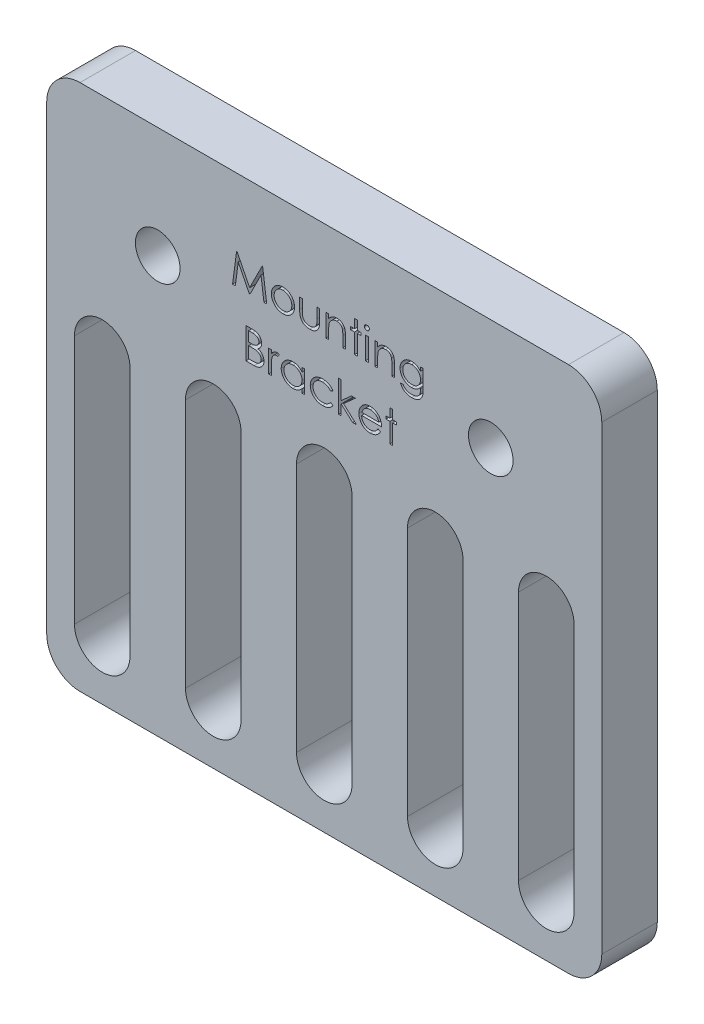
from build123d import *

# Parameters (mm, degrees)
SKETCH1_W           = 63.5
SKETCH1_H           = 60.325
BOSS_EXTRUDE1_DEPTH = 6.35
SKETCH2_R           = 2.5527
CUT_EXTRUDE1_DEPTH  = 113.534652957
FILLET2_R           = 3.81
FILLET3_R           = 3.81
SKETCH3_W           = 0.314102564
SKETCH3_H           = 2.557692308
CUT_EXTRUDE5_DEPTH  = 6.35
SKETCH4_R           = 1.7272
CUT_EXTRUDE6_DEPTH  = 6.35


with BuildPart() as part:
    # Sketch1 → Boss-Extrude1 (new body)
    with BuildSketch(Plane.XY):
        with Locations((-67.970991068, 21.600899779)):
            Rectangle(SKETCH1_W, SKETCH1_H)
    extrude(amount=BOSS_EXTRUDE1_DEPTH)

    # Sketch2 → Cut-Extrude1 (cut, through all)
    with BuildSketch(Plane.XY.offset(6.35)):
        with Locations((-87.020991068, 39.063399779)):
            Circle(SKETCH2_R)
        with Locations((-48.920991068, 39.063399779)):
            Circle(SKETCH2_R)
        with BuildLine():
            Line((-90.195991068, 26.363399779), (-90.195991068, -2.211600221))
            ThreePointArc((-90.195991068, -2.211600221), (-93.370991068, -5.386600221), (-96.545991068, -2.211600221))
            Line((-96.545991068, -2.211600221), (-96.545991068, 26.363399779))
            ThreePointArc((-96.545991068, 26.363399779), (-93.370991068, 29.538399779), (-90.195991068, 26.363399779))
        make_face()
        with BuildLine():
            Line((-77.495991068, 26.363399779), (-77.495991068, -2.211600221))
            ThreePointArc((-77.495991068, -2.211600221), (-80.670991068, -5.386600221), (-83.845991068, -2.211600221))
            Line((-83.845991068, -2.211600221), (-83.845991068, 26.363399779))
            ThreePointArc((-83.845991068, 26.363399779), (-80.670991068, 29.538399779), (-77.495991068, 26.363399779))
        make_face()
        with BuildLine():
            Line((-64.795991068, 26.363399779), (-64.795991068, -2.211600221))
            ThreePointArc((-64.795991068, -2.211600221), (-67.970991068, -5.386600221), (-71.145991068, -2.211600221))
            Line((-71.145991068, -2.211600221), (-71.145991068, 26.363399779))
            ThreePointArc((-71.145991068, 26.363399779), (-67.970991068, 29.538399779), (-64.795991068, 26.363399779))
        make_face()
        with BuildLine():
            Line((-52.095991068, 26.363399779), (-52.095991068, -2.211600221))
            ThreePointArc((-52.095991068, -2.211600221), (-55.270991068, -5.386600221), (-58.445991068, -2.211600221))
            Line((-58.445991068, -2.211600221), (-58.445991068, 26.363399779))
            ThreePointArc((-58.445991068, 26.363399779), (-55.270991068, 29.538399779), (-52.095991068, 26.363399779))
        make_face()
        with BuildLine():
            Line((-39.395991068, 26.363399779), (-39.395991068, -2.211600221))
            ThreePointArc((-39.395991068, -2.211600221), (-42.570991068, -5.386600221), (-45.745991068, -2.211600221))
            Line((-45.745991068, -2.211600221), (-45.745991068, 26.363399779))
            ThreePointArc((-45.745991068, 26.363399779), (-42.570991068, 29.538399779), (-39.395991068, 26.363399779))
        make_face()
    extrude(amount=-CUT_EXTRUDE1_DEPTH, mode=Mode.SUBTRACT)

    # Fillet2
    fillet2_edges = [part.edges().sort_by_distance(p)[0] for p in [
        (-36.220991068, 51.763399779, 3.175),
    ]]
    fillet(fillet2_edges, radius=FILLET2_R)

    # Fillet3
    fillet3_edges = [part.edges().sort_by_distance(p)[0] for p in [
        (-99.720991068, 51.763399779, 3.175),
        (-36.220991068, -8.561600221, 3.175),
        (-99.720991068, -8.561600221, 3.175),
    ]]
    fillet(fillet3_edges, radius=FILLET3_R)

    # Sketch3 → Cut-Extrude5 (cut)
    # profile 1 of 16: a face of its own
    with BuildSketch(Plane.XY.offset(6.35)):
        Polygon((-78.458521086, 40.516400784), (-77.996481824, 44.016400784), (-77.951610029, 44.016400784), (-76.506598009, 41.144605912), (-75.065091599, 44.016400784), (-75.019518683, 44.016400784), (-74.554674933, 40.516400784), (-74.87017974, 40.516400784), (-75.205315958, 43.034830271), (-76.468737433, 40.516400784), (-76.539550734, 40.516400784), (-77.807880061, 43.040439246), (-78.142315157, 40.516400784), align=None)
    # profile 2 of 16: a face of its own
    with BuildSketch(Plane.XY.offset(6.35)):
        with BuildLine():
            add(Edge.make_bspline(
                [(-72.691093202, 43.118964887), (-72.643101929, 43.117942996), (-72.549002771, 43.115939317), (-72.411194885, 43.094524351), (-72.27964975, 43.061776987), (-72.153863557, 43.016505425), (-72.035447262, 42.955823474), (-71.922676018, 42.883414183), (-71.815859009, 42.797631589), (-71.75183598, 42.731273521), (-71.719338394, 42.697590688)],
                knots=[0, 0, 0, 0, 1.054011418, 2.066658804, 3.057071809, 4.030435133, 4.997543892, 5.974964718, 6.972108034, 8, 8, 8, 8], degree=3))
            add(Edge.make_bspline(
                [(-71.719338394, 42.697590688), (-71.69135644, 42.665376702), (-71.63593406, 42.60157216), (-71.564868341, 42.498116547), (-71.503646781, 42.390976446), (-71.45458382, 42.27872912), (-71.415898796, 42.162354449), (-71.3884331, 42.041452437), (-71.372096165, 41.91629009), (-71.369893198, 41.831286252), (-71.368777497, 41.78823572)],
                knots=[0, 0, 0, 0, 1.025258237, 2.030674902, 3.01204498, 3.988269485, 4.97094183, 5.956517959, 6.965070386, 8, 8, 8, 8], degree=3))
            add(Edge.make_bspline(
                [(-71.368777497, 41.78823572), (-71.369758834, 41.744935662), (-71.371698002, 41.659372729), (-71.390041619, 41.533353363), (-71.418572705, 41.411158541), (-71.459404543, 41.293299847), (-71.511762652, 41.179417019), (-71.575653339, 41.07000747), (-71.651524957, 40.964855337), (-71.737528953, 40.864853499), (-71.83258083, 40.772687284), (-71.935696978, 40.692359014), (-72.044851012, 40.62353749), (-72.161494365, 40.568101074), (-72.284561852, 40.524391374), (-72.41431892, 40.493691358), (-72.55056399, 40.475129674), (-72.643591212, 40.4727461), (-72.691093202, 40.471528989)],
                knots=[0, 0, 0, 0, 0.998656419, 1.973391657, 2.932242238, 3.890759089, 4.846373663, 5.82037756, 6.809684879, 7.83454468, 8.860553229, 9.859544525, 10.845671541, 11.83227036, 12.833544569, 13.85385346, 14.904124723, 16, 16, 16, 16], degree=3))
            add(Edge.make_bspline(
                [(-72.691093202, 40.471528989), (-72.738827921, 40.472750185), (-72.832318781, 40.47514196), (-72.969044763, 40.493619243), (-73.099034382, 40.524377225), (-73.22226298, 40.568244718), (-73.339407827, 40.623539262), (-73.449194324, 40.692150951), (-73.55239424, 40.772711107), (-73.647466224, 40.864847044), (-73.73346483, 40.964857), (-73.809337838, 41.070007038), (-73.873228164, 41.179417132), (-73.925586368, 41.293299817), (-73.966418181, 41.411158549), (-73.994949273, 41.533353361), (-74.013292888, 41.65937273), (-74.015232057, 41.744935663), (-74.016213394, 41.78823572)],
                knots=[0, 0, 0, 0, 1.099876186, 2.154163076, 3.173186993, 4.173200201, 5.163417411, 6.152872554, 7.150605724, 8.17532212, 9.198891216, 10.186952605, 11.159729845, 12.11414092, 13.071450619, 14.029093627, 15.002601286, 16, 16, 16, 16], degree=3))
            add(Edge.make_bspline(
                [(-74.016213394, 41.78823572), (-74.015090084, 41.831052266), (-74.012866122, 41.915821668), (-73.996545613, 42.040748729), (-73.969187057, 42.161446118), (-73.93045566, 42.277371594), (-73.880940469, 42.38912703), (-73.820579181, 42.496531861), (-73.748788549, 42.599519662), (-73.693586597, 42.663241742), (-73.665652497, 42.695487323)],
                knots=[0, 0, 0, 0, 1.031353054, 2.041901799, 3.029428768, 4.008703097, 4.981709435, 5.96992636, 6.972712378, 8, 8, 8, 8], degree=3))
            add(Edge.make_bspline(
                [(-73.665652497, 42.695487323), (-73.633203906, 42.729462262), (-73.569388042, 42.796279958), (-73.462039314, 42.881812482), (-73.349545493, 42.955728556), (-73.229820567, 43.015204771), (-73.104137709, 43.062043289), (-72.971918466, 43.094608804), (-72.833642951, 43.115862159), (-72.73908333, 43.117920337), (-72.691093202, 43.118964887)],
                knots=[0, 0, 0, 0, 1.027980169, 2.021703884, 2.998553061, 3.971491411, 4.943284454, 5.930300938, 6.949603206, 8, 8, 8, 8], degree=3))
        make_face()
        with BuildLine():
            add(Edge.make_bspline(
                [(-72.692495445, 42.804862323), (-72.726433057, 42.803897731), (-72.793432185, 42.801993448), (-72.89205177, 42.787509544), (-72.986991924, 42.76456204), (-73.078432768, 42.731957983), (-73.166065941, 42.689859084), (-73.249975343, 42.638150724), (-73.330407783, 42.577517768), (-73.405789846, 42.508055096), (-73.474972158, 42.432176102), (-73.535450135, 42.351327743), (-73.586875241, 42.266821396), (-73.6297154, 42.178569185), (-73.661622588, 42.085676771), (-73.684795611, 41.98919614), (-73.699265851, 41.888930724), (-73.70115223, 41.820769705), (-73.70211083, 41.786132355)],
                knots=[0, 0, 0, 0, 1.021534396, 2.016698045, 2.994645724, 3.958388632, 4.93408049, 5.916473867, 6.921342795, 7.962252576, 8.998418191, 10.008913653, 10.997312074, 11.973003931, 12.956656626, 13.948281152, 14.957379055, 16, 16, 16, 16], degree=3))
            add(Edge.make_bspline(
                [(-73.70211083, 41.786132355), (-73.700504006, 41.741380327), (-73.697314762, 41.652555922), (-73.671379525, 41.521744799), (-73.627993246, 41.396162947), (-73.569405966, 41.276546561), (-73.495999747, 41.165874283), (-73.40951268, 41.067202799), (-73.31087298, 40.982016987), (-73.20125648, 40.911336142), (-73.082902162, 40.855176386), (-72.957645841, 40.81537741), (-72.827005147, 40.789505718), (-72.737724416, 40.786934244), (-72.692495445, 40.785631553)],
                knots=[0, 0, 0, 0, 1.016792936, 2.018143844, 3.017858371, 4.030088057, 5.03801393, 6.028138512, 7.003788237, 7.991172063, 8.984598303, 9.972568034, 10.972917682, 12, 12, 12, 12], degree=3))
            add(Edge.make_bspline(
                [(-72.692495445, 40.785631553), (-72.647269076, 40.786941834), (-72.55799348, 40.78952829), (-72.427534304, 40.81524711), (-72.302620332, 40.855350771), (-72.184388944, 40.911272981), (-72.074822341, 40.982285396), (-71.975473219, 41.066721773), (-71.889724608, 41.166135624), (-71.816391003, 41.276693153), (-71.756844261, 41.395977505), (-71.713661059, 41.521767977), (-71.687663473, 41.652550019), (-71.684482644, 41.74137835), (-71.682880061, 41.786132355)],
                knots=[0, 0, 0, 0, 1.02726834, 2.027799167, 3.010890988, 4.004497153, 4.992059811, 5.971914811, 6.958719428, 7.966827853, 8.981595046, 9.981490638, 10.983022906, 12, 12, 12, 12], degree=3))
            add(Edge.make_bspline(
                [(-71.682880061, 41.786132355), (-71.683838331, 41.820769912), (-71.68572406, 41.888931338), (-71.700199024, 41.989193792), (-71.723354564, 42.085685388), (-71.755326181, 42.178537392), (-71.797980195, 42.267049896), (-71.850396988, 42.351079623), (-71.910628014, 42.432456169), (-71.980645134, 42.50780981), (-72.055948512, 42.577544846), (-72.13641355, 42.638174236), (-72.220198529, 42.689631831), (-72.307577112, 42.732318072), (-72.399029679, 42.764265412), (-72.493836809, 42.787642044), (-72.592035618, 42.80193224), (-72.658794662, 42.803879382), (-72.692495445, 42.804862323)],
                knots=[0, 0, 0, 0, 1.042956736, 2.052379634, 3.044323526, 4.02829302, 5.004299113, 5.996692471, 7.007513377, 8.048758398, 9.090003419, 10.095195979, 11.07790575, 12.047570684, 13.018257071, 13.989683339, 14.985167495, 16, 16, 16, 16], degree=3))
        make_face(mode=Mode.SUBTRACT)
    # profile 3 of 16: a face of its own
    with BuildSketch(Plane.XY.offset(6.35)):
        with BuildLine():
            Line((-70.785444163, 43.074093092), (-70.471341599, 43.074093092))
            Line((-70.471341599, 43.074093092), (-70.471341599, 41.887795015))
            add(Edge.make_bspline(
                [(-70.471341599, 41.887795015), (-70.471199694, 41.852972266), (-70.470928237, 41.786357978), (-70.469087296, 41.690502791), (-70.464757202, 41.603086078), (-70.459343378, 41.524057342), (-70.452381242, 41.45342995), (-70.444097881, 41.391450593), (-70.43483946, 41.337416409), (-70.425776746, 41.304873053), (-70.421561952, 41.289738124)],
                knots=[0, 0, 0, 0, 1.388932606, 2.656963016, 3.823490214, 4.879454478, 5.816252168, 6.653371382, 7.373723809, 8, 8, 8, 8], degree=3))
            add(Edge.make_bspline(
                [(-70.421561952, 41.289738124), (-70.414800497, 41.270715253), (-70.401418156, 41.233064992), (-70.377144672, 41.178675987), (-70.347116335, 41.128300704), (-70.314256508, 41.079996631), (-70.2763571, 41.035194645), (-70.233897629, 40.993970401), (-70.188299392, 40.95476631), (-70.120544368, 40.908381518), (-70.027885102, 40.858666188), (-69.906232347, 40.815770369), (-69.774328121, 40.790134549), (-69.683163402, 40.787160294), (-69.636305542, 40.785631553)],
                knots=[0, 0, 0, 0, 0.725840625, 1.436591201, 2.137033971, 2.831655856, 3.53531722, 4.242432219, 4.957935707, 5.694543706, 7.190802206, 8.724350549, 10.316345118, 12, 12, 12, 12], degree=3))
            add(Edge.make_bspline(
                [(-69.636305542, 40.785631553), (-69.589452034, 40.787192802), (-69.498799165, 40.790213529), (-69.368344196, 40.814997068), (-69.249092782, 40.856402757), (-69.14224183, 40.914210169), (-69.04827599, 40.984952231), (-68.969971572, 41.06796104), (-68.905364317, 41.160610427), (-68.877154896, 41.229734706), (-68.862968202, 41.264497739)],
                knots=[0, 0, 0, 0, 1.157059328, 2.238695713, 3.266970494, 4.264342957, 5.228770407, 6.160125903, 7.074715775, 8, 8, 8, 8], degree=3))
            add(Edge.make_bspline(
                [(-68.862968202, 41.264497739), (-68.858773972, 41.278464038), (-68.849501553, 41.309340113), (-68.839539202, 41.361719862), (-68.83056474, 41.424184466), (-68.822901564, 41.497142675), (-68.817436401, 41.580403827), (-68.814490375, 41.673941904), (-68.8111621, 41.777463264), (-68.811111583, 41.849931023), (-68.811085189, 41.887795015)],
                knots=[0, 0, 0, 0, 0.557542046, 1.232589297, 2.036731608, 2.971723315, 4.038036528, 5.22795436, 6.551621927, 8, 8, 8, 8], degree=3))
            Line((-68.811085189, 41.887795015), (-68.811085189, 43.074093092))
            Line((-68.811085189, 43.074093092), (-68.496982625, 43.074093092))
            Line((-68.496982625, 43.074093092), (-68.496982625, 41.828900784))
            add(Edge.make_bspline(
                [(-68.496982625, 41.828900784), (-68.49742432, 41.786593613), (-68.498281268, 41.704511913), (-68.503788612, 41.585227801), (-68.513238224, 41.474065556), (-68.527580909, 41.370966337), (-68.544446584, 41.276008855), (-68.566202857, 41.189071409), (-68.592181094, 41.110421855), (-68.621486609, 41.038680078), (-68.656108477, 40.973633184), (-68.692935497, 40.911897367), (-68.735460269, 40.855004432), (-68.780230504, 40.800122295), (-68.830032159, 40.749980767), (-68.883932018, 40.703429292), (-68.941171438, 40.65975626), (-69.003020636, 40.62066498), (-69.068576699, 40.585448335), (-69.137920556, 40.554232257), (-69.211901554, 40.52952968), (-69.289565191, 40.508219014), (-69.371291971, 40.491504545), (-69.457003104, 40.479717978), (-69.54666972, 40.472492647), (-69.60777918, 40.471855602), (-69.639110029, 40.471528989)],
                knots=[0, 0, 0, 0, 1.493040784, 2.896703357, 4.213163133, 5.428574705, 6.569057535, 7.615249723, 8.588095153, 9.490268104, 10.346124644, 11.18633936, 12.024365274, 12.850166724, 13.684164916, 14.514361689, 15.362232829, 16.222528818, 17.093394965, 17.986930858, 18.902426812, 19.842810585, 20.827885679, 21.843828298, 22.894529745, 24, 24, 24, 24], degree=3))
            add(Edge.make_bspline(
                [(-69.639110029, 40.471528989), (-69.670206543, 40.471868696), (-69.731314088, 40.472536253), (-69.820985332, 40.47967806), (-69.906933938, 40.491486231), (-69.988854337, 40.508341448), (-70.066828734, 40.529380518), (-70.141172974, 40.554384054), (-70.211016537, 40.585464535), (-70.277198541, 40.620442093), (-70.339200929, 40.660007368), (-70.397309507, 40.703375408), (-70.45144636, 40.750481471), (-70.501623428, 40.801128828), (-70.547136405, 40.855945765), (-70.588552446, 40.914491325), (-70.626509151, 40.976185413), (-70.660861942, 41.042248576), (-70.690373697, 41.114820586), (-70.716428943, 41.195117683), (-70.737739582, 41.2840202), (-70.75508205, 41.381452128), (-70.769033491, 41.48694717), (-70.778719633, 41.601115585), (-70.784135464, 41.723679277), (-70.784998525, 41.808329167), (-70.785444163, 41.852037803)],
                knots=[0, 0, 0, 0, 1.083640291, 2.129454052, 3.13281866, 4.105697902, 5.042300162, 5.946461698, 6.836384745, 7.703652036, 8.553297018, 9.397182691, 10.228592656, 11.052265423, 11.879314572, 12.708807002, 13.549817954, 14.402308542, 15.300838682, 16.27712199, 17.341985831, 18.484375296, 19.725102775, 21.0496083, 22.476576903, 24, 24, 24, 24], degree=3))
            Line((-70.785444163, 41.852037803), (-70.785444163, 43.074093092))
        make_face()
    # profile 4 of 16: a face of its own
    with BuildSketch(Plane.XY.offset(6.35)):
        with BuildLine():
            Line((-67.779033907, 43.074093092), (-67.464931343, 43.074093092))
            Line((-67.464931343, 43.074093092), (-67.464931343, 42.612754951))
            add(Edge.make_bspline(
                [(-67.464931343, 42.612754951), (-67.431393708, 42.654597674), (-67.366312757, 42.735794937), (-67.257928423, 42.842515512), (-67.143384523, 42.930460737), (-67.02338252, 43.000564531), (-66.897759509, 43.053411157), (-66.767281239, 43.091577088), (-66.631166533, 43.114461916), (-66.538602096, 43.117452147), (-66.491774292, 43.118964887)],
                knots=[0, 0, 0, 0, 1.12780773, 2.188550248, 3.19190651, 4.159438251, 5.104880172, 6.052711206, 7.014878035, 8, 8, 8, 8], degree=3))
            add(Edge.make_bspline(
                [(-66.491774292, 43.118964887), (-66.444443657, 43.117219691), (-66.35180619, 43.113803923), (-66.216928128, 43.086787232), (-66.090954735, 43.040641977), (-65.974335179, 42.977429906), (-65.869207965, 42.898823433), (-65.776883114, 42.807245651), (-65.700519867, 42.701909568), (-65.649322504, 42.604186412), (-65.615596856, 42.517497617), (-65.594364518, 42.443250867), (-65.576333537, 42.360532716), (-65.560701789, 42.269593127), (-65.550124677, 42.169794937), (-65.541782385, 42.061547245), (-65.535803691, 41.944885114), (-65.535566484, 41.864198487), (-65.535444163, 41.822590688)],
                knots=[0, 0, 0, 0, 1.235846778, 2.418850247, 3.575807741, 4.728682307, 5.871620074, 6.994088408, 8.11269785, 9.256955736, 9.865816715, 10.540099792, 11.271859618, 12.076849838, 12.949306005, 13.892391288, 14.913166135, 16, 16, 16, 16], degree=3))
            Line((-65.535444163, 41.822590688), (-65.535444163, 40.516400784))
            Line((-65.535444163, 40.516400784), (-65.849546727, 40.516400784))
            Line((-65.849546727, 40.516400784), (-65.849546727, 41.719525784))
            add(Edge.make_bspline(
                [(-65.849546727, 41.719525784), (-65.849739935, 41.754348229), (-65.850109509, 41.82095764), (-65.851275156, 41.916326663), (-65.854084963, 42.002813241), (-65.858033276, 42.080210609), (-65.863812306, 42.148444445), (-65.869834938, 42.207653722), (-65.877199914, 42.257763265), (-65.883762827, 42.287928347), (-65.886706183, 42.301456874)],
                knots=[0, 0, 0, 0, 1.430800155, 2.736877192, 3.918605307, 4.986035426, 5.920637409, 6.731861385, 7.431261377, 8, 8, 8, 8], degree=3))
            add(Edge.make_bspline(
                [(-65.886706183, 42.301456874), (-65.897331714, 42.341168059), (-65.917782575, 42.417599803), (-65.968316558, 42.521274156), (-66.032130739, 42.609472344), (-66.110028588, 42.681649066), (-66.201257664, 42.737819902), (-66.305564806, 42.776793857), (-66.421943447, 42.801170126), (-66.50379783, 42.803597258), (-66.546461792, 42.804862323)],
                knots=[0, 0, 0, 0, 1.084156227, 2.086665306, 3.027808233, 3.945421172, 4.874247719, 5.839848303, 6.874090471, 8, 8, 8, 8], degree=3))
            add(Edge.make_bspline(
                [(-66.546461792, 42.804862323), (-66.571729475, 42.804386318), (-66.621733568, 42.803444317), (-66.69588354, 42.793993019), (-66.767807713, 42.778534563), (-66.838227922, 42.757665926), (-66.905735716, 42.729003657), (-66.972500007, 42.696474286), (-67.036006771, 42.655926074), (-67.097610168, 42.610735453), (-67.154922976, 42.560656246), (-67.208251314, 42.507811736), (-67.255789335, 42.451536132), (-67.29885801, 42.392736184), (-67.336036273, 42.330604346), (-67.368489361, 42.26574004), (-67.396025056, 42.198057891), (-67.409707749, 42.15108283), (-67.416553939, 42.127578669)],
                knots=[0, 0, 0, 0, 1.023777757, 2.026029729, 3.023749952, 4.003683103, 4.997618607, 5.993177895, 7.010360494, 8.046726602, 9.087585522, 10.09234134, 11.086953743, 12.070360549, 13.043493632, 14.017870808, 15.008233677, 16, 16, 16, 16], degree=3))
            add(Edge.make_bspline(
                [(-67.416553939, 42.127578669), (-67.420493588, 42.110323466), (-67.429069996, 42.072759791), (-67.438333176, 42.011115372), (-67.446740752, 41.939805397), (-67.45377771, 41.85891308), (-67.458083127, 41.768155205), (-67.462777523, 41.667919367), (-67.464486585, 41.557805879), (-67.464778939, 41.481144186), (-67.464931343, 41.441180432)],
                knots=[0, 0, 0, 0, 0.615963638, 1.340920617, 2.168419149, 3.115676021, 4.16674242, 5.331190069, 6.6087489, 8, 8, 8, 8], degree=3))
            Line((-67.464931343, 41.441180432), (-67.464931343, 40.516400784))
            Line((-67.464931343, 40.516400784), (-67.779033907, 40.516400784))
            Line((-67.779033907, 40.516400784), (-67.779033907, 43.074093092))
        make_face()
    # profile 5 of 16: a face of its own
    with BuildSketch(Plane.XY.offset(6.35)):
        Polygon((-64.503392881, 44.106144374), (-64.189290317, 44.106144374), (-64.189290317, 43.074093092), (-63.740572368, 43.074093092), (-63.740572368, 42.759990528), (-64.189290317, 42.759990528), (-64.189290317, 40.516400784), (-64.503392881, 40.516400784), (-64.503392881, 42.759990528), (-64.95211083, 42.759990528), (-64.95211083, 43.074093092), (-64.503392881, 43.074093092), align=None)
    # profile 6 of 16: a face of its own
    with BuildSketch(Plane.XY.offset(6.35)):
        with BuildLine():
            add(Edge.make_bspline(
                [(-63.091333586, 44.151016169), (-63.071842271, 44.150112016), (-63.033674531, 44.148341512), (-62.978481263, 44.133180035), (-62.928224251, 44.10748035), (-62.883646518, 44.073000669), (-62.845394631, 44.032451225), (-62.818613921, 43.985190257), (-62.801401525, 43.934131618), (-62.79932297, 43.898516529), (-62.798264676, 43.880383156)],
                knots=[0, 0, 0, 0, 1.055194115, 2.066272739, 3.074728998, 4.095836921, 5.109056067, 6.073838105, 7.019297344, 8, 8, 8, 8], degree=3))
            add(Edge.make_bspline(
                [(-62.798264676, 43.880383156), (-62.799346836, 43.862720503), (-62.801486138, 43.827803528), (-62.818600626, 43.777630056), (-62.845622864, 43.731025772), (-62.88362199, 43.690555062), (-62.928230751, 43.656094442), (-62.978479536, 43.630389703), (-63.033674985, 43.615229566), (-63.071842424, 43.613458877), (-63.091333586, 43.61255463)],
                knots=[0, 0, 0, 0, 0.96129708, 1.900370562, 2.859976407, 3.87933698, 4.906634145, 5.921202961, 6.938410037, 8, 8, 8, 8], degree=3))
            add(Edge.make_bspline(
                [(-63.091333586, 43.61255463), (-63.110601862, 43.613424351), (-63.148105042, 43.615117147), (-63.202471884, 43.630687165), (-63.252300373, 43.656103238), (-63.296965046, 43.690329423), (-63.334195239, 43.73127432), (-63.361293565, 43.777601614), (-63.378368527, 43.827810769), (-63.380513155, 43.862722935), (-63.381598009, 43.880383156)],
                knots=[0, 0, 0, 0, 1.054934014, 2.053291228, 3.073705704, 4.106921865, 5.123545215, 6.088680038, 7.033164197, 8, 8, 8, 8], degree=3))
            add(Edge.make_bspline(
                [(-63.381598009, 43.880383156), (-63.380536923, 43.898514006), (-63.378452882, 43.934124138), (-63.361280766, 43.985219171), (-63.334420958, 44.032200673), (-63.296940394, 44.073226172), (-63.252306934, 44.107471607), (-63.202470189, 44.132882589), (-63.14810549, 44.148453928), (-63.110602014, 44.150146542), (-63.091333586, 44.151016169)],
                knots=[0, 0, 0, 0, 0.98631895, 1.937192651, 2.907499808, 3.917963147, 4.944918757, 5.95915025, 6.951458133, 8, 8, 8, 8], degree=3))
        make_face()
    # profile 7 of 16: a face of its own
    with BuildSketch(Plane.XY.offset(6.35)):
        with Locations((-63.089931343, 41.795246938)):
            Rectangle(SKETCH3_W, SKETCH3_H)
    # profile 8 of 16: a face of its own
    with BuildSketch(Plane.XY.offset(6.35)):
        with BuildLine():
            Line((-62.170059548, 43.074093092), (-61.855956984, 43.074093092))
            Line((-61.855956984, 43.074093092), (-61.855956984, 42.612754951))
            add(Edge.make_bspline(
                [(-61.855956984, 42.612754951), (-61.822419349, 42.654597674), (-61.757338398, 42.735794937), (-61.648954064, 42.842515512), (-61.534410164, 42.930460737), (-61.414408161, 43.000564531), (-61.28878515, 43.053411157), (-61.15830688, 43.091577088), (-61.022192174, 43.114461916), (-60.929627738, 43.117452147), (-60.882799933, 43.118964887)],
                knots=[0, 0, 0, 0, 1.12780773, 2.188550248, 3.19190651, 4.159438251, 5.104880172, 6.052711206, 7.014878035, 8, 8, 8, 8], degree=3))
            add(Edge.make_bspline(
                [(-60.882799933, 43.118964887), (-60.835469298, 43.117219691), (-60.742831831, 43.113803923), (-60.607953769, 43.086787232), (-60.481980376, 43.040641977), (-60.36536082, 42.977429906), (-60.260233606, 42.898823433), (-60.167908755, 42.807245651), (-60.091545508, 42.701909568), (-60.040348145, 42.604186412), (-60.006622497, 42.517497617), (-59.985390159, 42.443250867), (-59.967359178, 42.360532716), (-59.95172743, 42.269593127), (-59.941150318, 42.169794937), (-59.932808026, 42.061547245), (-59.926829332, 41.944885114), (-59.926592125, 41.864198487), (-59.926469804, 41.822590688)],
                knots=[0, 0, 0, 0, 1.235846778, 2.418850247, 3.575807741, 4.728682307, 5.871620074, 6.994088408, 8.11269785, 9.256955736, 9.865816715, 10.540099792, 11.271859618, 12.076849838, 12.949306005, 13.892391288, 14.913166135, 16, 16, 16, 16], degree=3))
            Line((-59.926469804, 41.822590688), (-59.926469804, 40.516400784))
            Line((-59.926469804, 40.516400784), (-60.240572368, 40.516400784))
            Line((-60.240572368, 40.516400784), (-60.240572368, 41.719525784))
            add(Edge.make_bspline(
                [(-60.240572368, 41.719525784), (-60.240765576, 41.754348229), (-60.241135151, 41.82095764), (-60.242300797, 41.916326663), (-60.245110604, 42.002813241), (-60.249058917, 42.080210609), (-60.254837947, 42.148444445), (-60.260860579, 42.207653722), (-60.268225555, 42.257763265), (-60.274788469, 42.287928347), (-60.277731824, 42.301456874)],
                knots=[0, 0, 0, 0, 1.430800155, 2.736877192, 3.918605307, 4.986035426, 5.920637409, 6.731861385, 7.431261377, 8, 8, 8, 8], degree=3))
            add(Edge.make_bspline(
                [(-60.277731824, 42.301456874), (-60.288357355, 42.341168059), (-60.308808216, 42.417599803), (-60.359342199, 42.521274156), (-60.42315638, 42.609472344), (-60.501054229, 42.681649066), (-60.592283305, 42.737819902), (-60.696590447, 42.776793857), (-60.812969088, 42.801170126), (-60.894823471, 42.803597258), (-60.937487433, 42.804862323)],
                knots=[0, 0, 0, 0, 1.084156227, 2.086665306, 3.027808233, 3.945421172, 4.874247719, 5.839848303, 6.874090471, 8, 8, 8, 8], degree=3))
            add(Edge.make_bspline(
                [(-60.937487433, 42.804862323), (-60.962755116, 42.804386318), (-61.012759209, 42.803444317), (-61.086909181, 42.793993019), (-61.158833354, 42.778534563), (-61.229253563, 42.757665926), (-61.296761357, 42.729003657), (-61.363525648, 42.696474286), (-61.427032412, 42.655926074), (-61.488635809, 42.610735453), (-61.545948617, 42.560656246), (-61.599276955, 42.507811736), (-61.646814976, 42.451536132), (-61.689883651, 42.392736184), (-61.727061914, 42.330604346), (-61.759515002, 42.26574004), (-61.787050697, 42.198057891), (-61.80073339, 42.15108283), (-61.80757958, 42.127578669)],
                knots=[0, 0, 0, 0, 1.023777757, 2.026029729, 3.023749952, 4.003683103, 4.997618607, 5.993177895, 7.010360494, 8.046726602, 9.087585522, 10.09234134, 11.086953743, 12.070360549, 13.043493632, 14.017870808, 15.008233677, 16, 16, 16, 16], degree=3))
            add(Edge.make_bspline(
                [(-61.80757958, 42.127578669), (-61.811519229, 42.110323466), (-61.820095637, 42.072759791), (-61.829358817, 42.011115372), (-61.837766393, 41.939805397), (-61.844803351, 41.85891308), (-61.849108768, 41.768155205), (-61.853803165, 41.667919367), (-61.855512226, 41.557805879), (-61.85580458, 41.481144186), (-61.855956984, 41.441180432)],
                knots=[0, 0, 0, 0, 0.615963638, 1.340920617, 2.168419149, 3.115676021, 4.16674242, 5.331190069, 6.6087489, 8, 8, 8, 8], degree=3))
            Line((-61.855956984, 41.441180432), (-61.855956984, 40.516400784))
            Line((-61.855956984, 40.516400784), (-62.170059548, 40.516400784))
            Line((-62.170059548, 40.516400784), (-62.170059548, 43.074093092))
        make_face()
    # profile 9 of 16: a face of its own
    with BuildSketch(Plane.XY.offset(6.35)):
        with BuildLine():
            Line((-56.964931343, 43.074093092), (-56.650828779, 43.074093092))
            Line((-56.650828779, 43.074093092), (-56.650828779, 41.044345496))
            add(Edge.make_bspline(
                [(-56.650828779, 41.044345496), (-56.651105821, 41.001107901), (-56.65164058, 40.917648928), (-56.655491551, 40.796970649), (-56.663612229, 40.685504563), (-56.67282091, 40.582742305), (-56.686067626, 40.489160195), (-56.702243994, 40.40447899), (-56.720479673, 40.328617428), (-56.73649989, 40.281892587), (-56.744077977, 40.259790207)],
                knots=[0, 0, 0, 0, 1.307562039, 2.523909702, 3.650326591, 4.686913197, 5.643429486, 6.506965704, 7.293745905, 8, 8, 8, 8], degree=3))
            add(Edge.make_bspline(
                [(-56.744077977, 40.259790207), (-56.755267216, 40.231060286), (-56.777311143, 40.174459449), (-56.818596776, 40.094225128), (-56.86483068, 40.018678738), (-56.91763743, 39.948241287), (-56.976778234, 39.883266374), (-57.040859726, 39.822342375), (-57.111129918, 39.766758208), (-57.18754863, 39.71747291), (-57.268354263, 39.673085856), (-57.353500365, 39.634639289), (-57.442506804, 39.601152445), (-57.536209695, 39.576069649), (-57.63313993, 39.554334929), (-57.734437361, 39.540190243), (-57.839510158, 39.530563185), (-57.910955538, 39.529672952), (-57.947202977, 39.529221297)],
                knots=[0, 0, 0, 0, 0.981931301, 1.934503488, 2.87077864, 3.801706999, 4.735015492, 5.667491629, 6.616593066, 7.585388521, 8.561939025, 9.551802639, 10.560317337, 11.588439944, 12.640189604, 13.723962949, 14.845264515, 16, 16, 16, 16], degree=3))
            add(Edge.make_bspline(
                [(-57.947202977, 39.529221297), (-58.000087712, 39.530077783), (-58.103385807, 39.53175073), (-58.2539908, 39.551241645), (-58.39702552, 39.578796018), (-58.530599977, 39.620501445), (-58.653870073, 39.671538435), (-58.765993949, 39.730133388), (-58.865965056, 39.797322697), (-58.956088729, 39.873823298), (-59.03743032, 39.96478698), (-59.11395761, 40.071985824), (-59.187618551, 40.197052713), (-59.230787189, 40.288845426), (-59.253392881, 40.336913605)],
                knots=[0, 0, 0, 0, 1.157897085, 2.2616841, 3.32207898, 4.345638746, 5.321241055, 6.241986252, 7.112515963, 7.955008012, 8.825025602, 9.77857164, 10.836726669, 12, 12, 12, 12], degree=3))
            Line((-59.253392881, 40.336913605), (-58.939290317, 40.336913605))
            add(Edge.make_bspline(
                [(-58.939290317, 40.336913605), (-58.914028108, 40.296807729), (-58.864643599, 40.21840568), (-58.772295118, 40.116892524), (-58.671088792, 40.03013916), (-58.557609109, 39.960228386), (-58.431383894, 39.907518594), (-58.292337207, 39.869943298), (-58.139337586, 39.847447031), (-58.032819371, 39.844735737), (-57.977351215, 39.843323861)],
                knots=[0, 0, 0, 0, 0.997731894, 1.950442991, 2.880492273, 3.800895997, 4.748200782, 5.754801363, 6.83083817, 8, 8, 8, 8], degree=3))
            add(Edge.make_bspline(
                [(-57.977351215, 39.843323861), (-57.922584324, 39.84475401), (-57.816999242, 39.847511194), (-57.665168073, 39.869953338), (-57.526573134, 39.907526772), (-57.402012934, 39.960135158), (-57.292957165, 40.024585564), (-57.198945174, 40.096585639), (-57.122800498, 40.177766642), (-57.071587531, 40.252548448), (-57.039752914, 40.319172578), (-57.019480677, 40.376525173), (-57.003006707, 40.441378051), (-56.98922687, 40.513513787), (-56.977855956, 40.593035444), (-56.970653074, 40.680124848), (-56.965447263, 40.77458407), (-56.965107293, 40.840077208), (-56.964931343, 40.8739729)],
                knots=[0, 0, 0, 0, 1.570740765, 3.028230971, 4.391408896, 5.680370741, 6.894727393, 8.017376726, 9.065722033, 10.075533815, 10.603371122, 11.180248986, 11.817768598, 12.521299649, 13.286540596, 14.121245857, 15.027658897, 16, 16, 16, 16], degree=3))
            Line((-56.964931343, 40.8739729), (-56.964931343, 41.006484919))
            add(Edge.make_bspline(
                [(-56.964931343, 41.006484919), (-56.99681246, 40.968543117), (-57.060013916, 40.893326897), (-57.169161243, 40.79476526), (-57.288378159, 40.70987913), (-57.417461701, 40.640260495), (-57.553249943, 40.584579071), (-57.694272174, 40.54563611), (-57.839264229, 40.52047621), (-57.937516379, 40.517768894), (-57.98716692, 40.516400784)],
                knots=[0, 0, 0, 0, 1.012485704, 2.007162095, 2.997754123, 3.998611389, 4.999708251, 5.992315798, 6.98544096, 8, 8, 8, 8], degree=3))
            add(Edge.make_bspline(
                [(-57.98716692, 40.516400784), (-58.016403189, 40.516915811), (-58.074529747, 40.517939769), (-58.160884494, 40.526898546), (-58.245964932, 40.539897288), (-58.329572636, 40.558978727), (-58.411828249, 40.583470454), (-58.492595841, 40.614087193), (-58.572529368, 40.648702311), (-58.650175865, 40.689475114), (-58.724761996, 40.734837421), (-58.795725181, 40.783976312), (-58.86269372, 40.8366346), (-58.92503021, 40.89333154), (-58.982652881, 40.953985073), (-59.036336749, 41.017948626), (-59.085194096, 41.086115367), (-59.130227486, 41.157242325), (-59.169285036, 41.231803249), (-59.203569408, 41.308181344), (-59.233378813, 41.386213298), (-59.257144215, 41.466160361), (-59.275295328, 41.54797213), (-59.288805555, 41.631514579), (-59.296468487, 41.717044966), (-59.297663411, 41.774666316), (-59.298264676, 41.8036604)],
                knots=[0, 0, 0, 0, 1.028754217, 2.045334182, 3.052854819, 4.056607503, 5.061168794, 6.071104265, 7.095078842, 8.125279047, 9.155117945, 10.165957491, 11.161587969, 12.151493252, 13.128948131, 14.104219989, 15.088194871, 16.07871515, 17.064853787, 18.047899887, 19.02414258, 20.002704429, 20.980574569, 21.971845993, 22.979467364, 24, 24, 24, 24], degree=3))
            add(Edge.make_bspline(
                [(-59.298264676, 41.8036604), (-59.29774551, 41.832663496), (-59.296709188, 41.890557354), (-59.287758209, 41.97643674), (-59.274990019, 42.061166175), (-59.25478225, 42.143872317), (-59.230459728, 42.225497068), (-59.200336155, 42.305437525), (-59.164117396, 42.383718034), (-59.123107646, 42.460396565), (-59.077023554, 42.53444418), (-59.026491073, 42.604770826), (-58.971449199, 42.670858998), (-58.912657283, 42.73337542), (-58.849397466, 42.791716913), (-58.781702474, 42.845741878), (-58.710239593, 42.896355904), (-58.634787343, 42.942467242), (-58.556509955, 42.983249488), (-58.477396137, 43.020462085), (-58.396397902, 43.049996205), (-58.315025363, 43.076019304), (-58.231845448, 43.094454499), (-58.147878054, 43.108676741), (-58.062835716, 43.117341462), (-58.005882821, 43.118423047), (-57.977351215, 43.118964887)],
                knots=[0, 0, 0, 0, 1.008818848, 2.013730394, 3.001654427, 3.987803273, 4.973046549, 5.963777569, 6.957074694, 7.972068341, 8.987420212, 9.989399531, 10.982630087, 11.977756091, 12.973280677, 13.973972381, 14.989194003, 16.018387222, 17.047741039, 18.059210846, 19.057554164, 20.045176975, 21.029480261, 22.018708529, 23.007435371, 24, 24, 24, 24], degree=3))
            add(Edge.make_bspline(
                [(-57.977351215, 43.118964887), (-57.930300276, 43.117608213), (-57.837389128, 43.114929201), (-57.700658126, 43.093908055), (-57.568715886, 43.060394042), (-57.44081787, 43.012378411), (-57.315922219, 42.946828373), (-57.194440564, 42.860485425), (-57.07602143, 42.752575085), (-57.002943599, 42.669822221), (-56.964931343, 42.626777387)],
                knots=[0, 0, 0, 0, 0.96728863, 1.910097829, 2.838038873, 3.762875196, 4.71315279, 5.730631239, 6.819562287, 8, 8, 8, 8], degree=3))
            Line((-56.964931343, 42.626777387), (-56.964931343, 43.074093092))
        make_face()
        with BuildLine():
            add(Edge.make_bspline(
                [(-57.95211083, 42.804862323), (-57.998041534, 42.803301257), (-58.088974588, 42.800210678), (-58.222262931, 42.773825965), (-58.350939864, 42.732480065), (-58.472545292, 42.67333745), (-58.586452402, 42.601243212), (-58.687527223, 42.513902924), (-58.775932139, 42.414156727), (-58.850715077, 42.30290648), (-58.910246444, 42.182884205), (-58.952389863, 42.056373471), (-58.979639886, 41.925418478), (-58.982647538, 41.836045875), (-58.984162112, 41.791040207)],
                knots=[0, 0, 0, 0, 1.026226791, 2.031711442, 3.026614839, 4.04107745, 5.047145931, 6.032893242, 7.017642609, 8.019221815, 9.021877557, 10.003543541, 10.994637589, 12, 12, 12, 12], degree=3))
            add(Edge.make_bspline(
                [(-58.984162112, 41.791040207), (-58.983436355, 41.757106935), (-58.982009004, 41.690370111), (-58.968285426, 41.592432216), (-58.946104461, 41.499151902), (-58.914667255, 41.410523528), (-58.87571456, 41.326038733), (-58.826722189, 41.246279498), (-58.769071217, 41.171174792), (-58.703212879, 41.10128011), (-58.630636497, 41.037619142), (-58.551917298, 40.981681101), (-58.467162048, 40.93593038), (-58.378455238, 40.896389543), (-58.283644482, 40.867510475), (-58.184095396, 40.845471696), (-58.079103699, 40.832862938), (-58.00753196, 40.83130014), (-57.971041118, 40.830503348)],
                knots=[0, 0, 0, 0, 1.039728707, 2.044842319, 3.024901384, 3.974314358, 4.923051295, 5.871625912, 6.837440708, 7.820715446, 8.810779094, 9.792721783, 10.773906224, 11.758876063, 12.764959493, 13.806266761, 14.881525401, 16, 16, 16, 16], degree=3))
            add(Edge.make_bspline(
                [(-57.971041118, 40.830503348), (-57.93407736, 40.831270957), (-57.861795123, 40.832772009), (-57.756224186, 40.845675507), (-57.656191446, 40.866497483), (-57.561788624, 40.896060509), (-57.472659283, 40.933782259), (-57.389804668, 40.981518877), (-57.31144822, 41.035883309), (-57.24009181, 41.099295323), (-57.175567645, 41.169180318), (-57.119336878, 41.245225213), (-57.071422429, 41.326285732), (-57.031744759, 41.412352738), (-57.001453555, 41.504095091), (-56.98113465, 41.601283447), (-56.966927905, 41.703452186), (-56.96560698, 41.773460802), (-56.964931343, 41.809269374)],
                knots=[0, 0, 0, 0, 1.121943988, 2.193949579, 3.223793937, 4.220241907, 5.192961521, 6.155822191, 7.11847367, 8.083710714, 9.04790392, 10.001595906, 10.949595423, 11.902125208, 12.873731292, 13.87582262, 14.913508608, 16, 16, 16, 16], degree=3))
            add(Edge.make_bspline(
                [(-56.964931343, 41.809269374), (-56.966270911, 41.855887228), (-56.968887956, 41.946962133), (-56.993585114, 42.079668901), (-57.033405324, 42.204437575), (-57.089252077, 42.32087355), (-57.159234085, 42.4277431), (-57.243524934, 42.523066945), (-57.340670965, 42.606967801), (-57.450393065, 42.676865995), (-57.56844051, 42.733331429), (-57.691961706, 42.775693201), (-57.82077327, 42.799687516), (-57.90807968, 42.80312746), (-57.95211083, 42.804862323)],
                knots=[0, 0, 0, 0, 1.070913519, 2.092188694, 3.091357305, 4.074328408, 5.051968682, 6.018948707, 6.99050112, 7.9935919, 9.000589572, 9.992915277, 10.987769056, 12, 12, 12, 12], degree=3))
        make_face(mode=Mode.SUBTRACT)
    # profile 10 of 16: a face of its own
    with BuildSketch(Plane.XY.offset(6.35)):
        with BuildLine():
            Line((-76.932880061, 37.183067451), (-76.249987433, 37.183067451))
            add(Edge.make_bspline(
                [(-76.249987433, 37.183067451), (-76.216558954, 37.1828917), (-76.151766244, 37.182551052), (-76.057546802, 37.177267921), (-75.969297992, 37.170064251), (-75.886994219, 37.158634159), (-75.810673517, 37.144842382), (-75.74010588, 37.128140565), (-75.675515707, 37.108113952), (-75.598402971, 37.076267671), (-75.51048231, 37.028944502), (-75.415283917, 36.959015937), (-75.333879678, 36.873483474), (-75.263693361, 36.777000819), (-75.207892241, 36.670865047), (-75.167522944, 36.557605858), (-75.141965068, 36.438684116), (-75.139336634, 36.357040938), (-75.138008266, 36.315779791)],
                knots=[0, 0, 0, 0, 1.001505555, 1.941167018, 2.826882275, 3.653841531, 4.429895133, 5.150066043, 5.825578002, 6.45369114, 7.647487171, 8.808567382, 9.977351308, 11.170798116, 12.373658725, 13.556498008, 14.765093433, 16, 16, 16, 16], degree=3))
            add(Edge.make_bspline(
                [(-75.138008266, 36.315779791), (-75.139101484, 36.277127235), (-75.141249762, 36.201171318), (-75.161792521, 36.090077209), (-75.193953189, 35.98432599), (-75.238658439, 35.884303604), (-75.296760435, 35.792269991), (-75.365618753, 35.707482725), (-75.448695556, 35.633531668), (-75.510938796, 35.592188766), (-75.542555542, 35.571188444)],
                knots=[0, 0, 0, 0, 1.044552857, 2.05264487, 3.044412934, 4.028983338, 5.005914585, 5.980388656, 6.974128949, 8, 8, 8, 8], degree=3))
            add(Edge.make_bspline(
                [(-75.542555542, 35.571188444), (-75.502795114, 35.555923445), (-75.426723567, 35.526717721), (-75.322037554, 35.475082257), (-75.231842709, 35.418920147), (-75.155445563, 35.357588297), (-75.090107908, 35.291479486), (-75.033054967, 35.219624371), (-74.984373592, 35.141085614), (-74.942660669, 35.056682078), (-74.910111913, 34.96727561), (-74.885736009, 34.873704834), (-74.871768559, 34.776305279), (-74.869780918, 34.710019899), (-74.868777497, 34.676557034)],
                knots=[0, 0, 0, 0, 1.27268992, 2.434971085, 3.483601985, 4.442670788, 5.356604649, 6.2567628, 7.179492994, 8.113709626, 9.066344395, 10.018646069, 10.999752585, 12, 12, 12, 12], degree=3))
            add(Edge.make_bspline(
                [(-74.868777497, 34.676557034), (-74.869754343, 34.642390162), (-74.871676315, 34.575165884), (-74.885856286, 34.476410749), (-74.909865393, 34.382035803), (-74.94293654, 34.29143062), (-74.986098854, 34.204770486), (-75.038626819, 34.121957222), (-75.101258382, 34.043822891), (-75.171321251, 33.969499268), (-75.250583397, 33.902671481), (-75.336099152, 33.843155774), (-75.428945472, 33.794209712), (-75.527597466, 33.75309369), (-75.633161782, 33.721686492), (-75.745164389, 33.699713918), (-75.863508691, 33.684908881), (-75.944718442, 33.683691676), (-75.986365638, 33.683067451)],
                knots=[0, 0, 0, 0, 0.978564426, 1.925352924, 2.850884081, 3.763762016, 4.682927383, 5.618979971, 6.567305752, 7.547517671, 8.540179244, 9.531824382, 10.526200242, 11.540722885, 12.589160233, 13.674978461, 14.80764778, 16, 16, 16, 16], degree=3))
            Line((-75.986365638, 33.683067451), (-76.932880061, 33.683067451))
            Line((-76.932880061, 33.683067451), (-76.932880061, 37.183067451))
        make_face()
        with BuildLine():
            Line((-76.618777497, 36.824093092), (-76.618777497, 35.70229822))
            Line((-76.618777497, 35.70229822), (-76.407739836, 35.70229822))
            add(Edge.make_bspline(
                [(-76.407739836, 35.70229822), (-76.376891041, 35.702698143), (-76.317284882, 35.703470876), (-76.230964985, 35.705684393), (-76.150839967, 35.711882436), (-76.077048134, 35.718078698), (-76.00970569, 35.728153286), (-75.948961828, 35.740145409), (-75.893863232, 35.752828314), (-75.830323686, 35.774397801), (-75.758250738, 35.806275476), (-75.681417633, 35.855747312), (-75.613683164, 35.914671665), (-75.556485976, 35.982662627), (-75.509674506, 36.057528813), (-75.47716079, 36.138075693), (-75.455113506, 36.222295825), (-75.453121975, 36.280114078), (-75.45211083, 36.309469694)],
                knots=[0, 0, 0, 0, 1.156816544, 2.235205308, 3.236616184, 4.169592532, 5.011045266, 5.787822928, 6.49130361, 7.128639758, 8.301311294, 9.436451833, 10.541879658, 11.654887649, 12.756523258, 13.837046038, 14.901820046, 16, 16, 16, 16], degree=3))
            add(Edge.make_bspline(
                [(-75.45211083, 36.309469694), (-75.45263701, 36.328895466), (-75.45366917, 36.367001238), (-75.462122473, 36.422550592), (-75.476490047, 36.474794345), (-75.49494434, 36.524448455), (-75.520733029, 36.569960305), (-75.551096492, 36.612903501), (-75.587782183, 36.651815619), (-75.629539495, 36.688185118), (-75.677548118, 36.720429646), (-75.73177941, 36.748670409), (-75.792967087, 36.771411185), (-75.860079942, 36.791327338), (-75.93415103, 36.805315632), (-76.014325583, 36.816969019), (-76.101260302, 36.822901761), (-76.161405404, 36.823687124), (-76.192495445, 36.824093092)],
                knots=[0, 0, 0, 0, 0.91205012, 1.789085906, 2.630437955, 3.453916878, 4.269457761, 5.079663411, 5.91843418, 6.774407191, 7.675494373, 8.627863946, 9.638891023, 10.736472738, 11.911756761, 13.175263542, 14.539845004, 16, 16, 16, 16], degree=3))
            Line((-76.192495445, 36.824093092), (-76.618777497, 36.824093092))
        make_face(mode=Mode.SUBTRACT)
        with BuildLine():
            Line((-76.618777497, 35.343323861), (-76.618777497, 34.04204181))
            Line((-76.618777497, 34.04204181), (-76.171461792, 34.04204181))
            add(Edge.make_bspline(
                [(-76.171461792, 34.04204181), (-76.139442866, 34.042425557), (-76.077730607, 34.04316518), (-75.988629377, 34.045579734), (-75.906046273, 34.05107201), (-75.830358137, 34.05971786), (-75.760747685, 34.069096309), (-75.698049982, 34.08170759), (-75.641756788, 34.09615655), (-75.57648248, 34.118490722), (-75.502978972, 34.153187193), (-75.423768116, 34.20550142), (-75.353341898, 34.267824728), (-75.293536638, 34.339955642), (-75.24452365, 34.418386969), (-75.208868195, 34.501532319), (-75.186877338, 34.588017846), (-75.184215169, 34.646984559), (-75.182880061, 34.676557034)],
                knots=[0, 0, 0, 0, 1.160039823, 2.235823828, 3.228722157, 4.157150951, 4.99529583, 5.772374946, 6.472645482, 7.099169577, 8.269452708, 9.405989375, 10.527446681, 11.663510218, 12.788923519, 13.866172445, 14.929861265, 16, 16, 16, 16], degree=3))
            add(Edge.make_bspline(
                [(-75.182880061, 34.676557034), (-75.183156165, 34.695050375), (-75.18370392, 34.731738756), (-75.191964535, 34.785654576), (-75.203978405, 34.837880449), (-75.219509839, 34.888558189), (-75.242129306, 34.936771566), (-75.268535851, 34.983474125), (-75.299497253, 35.028727605), (-75.347741418, 35.085939858), (-75.417913403, 35.151856871), (-75.517620178, 35.216394373), (-75.630992476, 35.26844218), (-75.713219969, 35.290541657), (-75.755696567, 35.301957675)],
                knots=[0, 0, 0, 0, 0.723448775, 1.435228256, 2.130040452, 2.821711965, 3.505591119, 4.210454504, 4.921174351, 5.648778258, 7.137944449, 8.670945889, 10.280296675, 12, 12, 12, 12], degree=3))
            add(Edge.make_bspline(
                [(-75.755696567, 35.301957675), (-75.772725663, 35.305412759), (-75.809648255, 35.312904094), (-75.869855836, 35.320811797), (-75.938591705, 35.327856857), (-76.016014582, 35.333068015), (-76.102222423, 35.338454558), (-76.197399342, 35.340549379), (-76.301156656, 35.34304864), (-76.373149029, 35.343229774), (-76.410544324, 35.343323861)],
                knots=[0, 0, 0, 0, 0.634451884, 1.375622551, 2.216452059, 3.157844607, 4.20941857, 5.370758133, 6.634282058, 8, 8, 8, 8], degree=3))
            Line((-76.410544324, 35.343323861), (-76.618777497, 35.343323861))
        make_face(mode=Mode.SUBTRACT)
    # profile 11 of 16: a face of its own
    with BuildSketch(Plane.XY.offset(6.35)):
        with BuildLine():
            Line((-74.330315958, 36.240759759), (-74.016213394, 36.240759759))
            Line((-74.016213394, 36.240759759), (-74.016213394, 35.864257355))
            add(Edge.make_bspline(
                [(-74.016213394, 35.864257355), (-73.993024635, 35.899313183), (-73.948676314, 35.966357182), (-73.874963385, 36.055026483), (-73.799460054, 36.12844153), (-73.721804866, 36.186945049), (-73.641426767, 36.230758167), (-73.560089815, 36.262851203), (-73.476514345, 36.281828518), (-73.420352421, 36.284362177), (-73.392214997, 36.285631553)],
                knots=[0, 0, 0, 0, 1.2804753, 2.448899062, 3.506932113, 4.484331642, 5.4025378, 6.288909075, 7.142734305, 8, 8, 8, 8], degree=3))
            add(Edge.make_bspline(
                [(-73.392214997, 36.285631553), (-73.37038867, 36.284441027), (-73.325479585, 36.281991441), (-73.257496995, 36.264780616), (-73.187453543, 36.237302594), (-73.142311156, 36.211462371), (-73.118777497, 36.197991329)],
                knots=[0, 0, 0, 0, 0.901110191, 1.854092781, 2.881294221, 4, 4, 4, 4], degree=3))
            Line((-73.118777497, 36.197991329), (-73.291253458, 35.925956073))
            add(Edge.make_bspline(
                [(-73.291253458, 35.925956073), (-73.306362479, 35.932696339), (-73.335042294, 35.945490654), (-73.37699686, 35.960632664), (-73.415678197, 35.96954858), (-73.440321755, 35.970899298), (-73.451810349, 35.971528989)],
                knots=[0, 0, 0, 0, 1.180555205, 2.24091978, 3.179933427, 4, 4, 4, 4], degree=3))
            add(Edge.make_bspline(
                [(-73.451810349, 35.971528989), (-73.477016083, 35.969848952), (-73.528428473, 35.966422163), (-73.603912972, 35.939483355), (-73.677160178, 35.895958115), (-73.73533184, 35.847687003), (-73.780374093, 35.801139205), (-73.812514318, 35.760490803), (-73.841997065, 35.714912171), (-73.870167286, 35.665182488), (-73.89583358, 35.610452642), (-73.919788249, 35.551269428), (-73.941447112, 35.487564299), (-73.953797356, 35.443181779), (-73.96012365, 35.420447259)],
                knots=[0, 0, 0, 0, 1.125678352, 2.296057538, 3.5422874, 4.923748041, 5.663163013, 6.437101912, 7.23742474, 8.08941207, 8.991984279, 9.93940061, 10.944477711, 12, 12, 12, 12], degree=3))
            add(Edge.make_bspline(
                [(-73.96012365, 35.420447259), (-73.964856044, 35.400170085), (-73.975337936, 35.355257686), (-73.985529473, 35.279909162), (-73.995598991, 35.190885503), (-74.00269561, 35.08793891), (-74.009273652, 34.971326466), (-74.012983734, 34.84087052), (-74.016086875, 34.696437169), (-74.016169941, 34.595462816), (-74.016213394, 34.542642771)],
                knots=[0, 0, 0, 0, 0.566838948, 1.255505196, 2.06880316, 3.007127437, 4.065329342, 5.249902469, 6.561414163, 8, 8, 8, 8], degree=3))
            Line((-74.016213394, 34.542642771), (-74.016213394, 33.683067451))
            Line((-74.016213394, 33.683067451), (-74.330315958, 33.683067451))
            Line((-74.330315958, 33.683067451), (-74.330315958, 36.240759759))
        make_face()
    # profile 12 of 16: a face of its own
    with BuildSketch(Plane.XY.offset(6.35)):
        with BuildLine():
            Line((-70.20211083, 36.240759759), (-70.20211083, 33.683067451))
            Line((-70.20211083, 33.683067451), (-70.516213394, 33.683067451))
            Line((-70.516213394, 33.683067451), (-70.516213394, 34.125475303))
            add(Edge.make_bspline(
                [(-70.516213394, 34.125475303), (-70.551632185, 34.085435709), (-70.6207524, 34.007297938), (-70.736193518, 33.905215766), (-70.858561696, 33.820837444), (-70.987263017, 33.752687529), (-71.12218126, 33.701495472), (-71.263017348, 33.665109313), (-71.409828728, 33.641715478), (-71.510081083, 33.639379456), (-71.560884868, 33.638195656)],
                knots=[0, 0, 0, 0, 1.074387032, 2.096679803, 3.090159297, 4.057316773, 5.018401886, 5.985159533, 6.978961417, 8, 8, 8, 8], degree=3))
            add(Edge.make_bspline(
                [(-71.560884868, 33.638195656), (-71.606052822, 33.639422028), (-71.695126027, 33.641840489), (-71.826155104, 33.660602792), (-71.952247354, 33.690733414), (-72.073521926, 33.732634303), (-72.189194072, 33.788215125), (-72.300254169, 33.854756373), (-72.406126861, 33.933997203), (-72.505198399, 34.024585231), (-72.5964304, 34.122980219), (-72.676491672, 34.227925766), (-72.743244752, 34.338968069), (-72.799064833, 34.454701223), (-72.842061177, 34.576016143), (-72.872034812, 34.702493311), (-72.890775258, 34.833983184), (-72.893192719, 34.923522707), (-72.894418522, 34.968924823)],
                knots=[0, 0, 0, 0, 1.033919861, 2.038935746, 3.024066025, 3.998881131, 4.97069526, 5.957263378, 6.95902576, 7.993208707, 9.027059324, 10.027763471, 11.009749337, 11.988697705, 12.965288445, 13.950418724, 14.960734635, 16, 16, 16, 16], degree=3))
            add(Edge.make_bspline(
                [(-72.894418522, 34.968924823), (-72.893165551, 35.013388526), (-72.890688494, 35.101290869), (-72.872235274, 35.230569567), (-72.841204266, 35.355087828), (-72.797656418, 35.474444771), (-72.741814463, 35.588784822), (-72.673886376, 35.698188847), (-72.593867251, 35.802958244), (-72.501614844, 35.900629471), (-72.401680074, 35.990850085), (-72.294771343, 36.069259131), (-72.183548062, 36.136975979), (-72.066285051, 36.190629456), (-71.944717946, 36.23403856), (-71.817764501, 36.264071528), (-71.685952922, 36.28176885), (-71.59646243, 36.284331614), (-71.551069163, 36.285631553)],
                knots=[0, 0, 0, 0, 1.020392517, 2.01726096, 2.990465484, 3.961182959, 4.928053699, 5.906110375, 6.912531644, 7.948652711, 8.985773172, 9.998621852, 10.987621588, 11.969261332, 12.953316658, 13.946091881, 14.958173133, 16, 16, 16, 16], degree=3))
            add(Edge.make_bspline(
                [(-71.551069163, 36.285631553), (-71.498869304, 36.284193802), (-71.396507844, 36.281374439), (-71.246779835, 36.257911712), (-71.105135357, 36.218273244), (-70.970481005, 36.164355746), (-70.843300319, 36.092707017), (-70.724797335, 36.002327056), (-70.613731851, 35.893785869), (-70.54935156, 35.810415425), (-70.516213394, 35.767502547)],
                knots=[0, 0, 0, 0, 1.038897134, 2.037228247, 3.008116434, 3.962042015, 4.918381754, 5.904844433, 6.921570401, 8, 8, 8, 8], degree=3))
            Line((-70.516213394, 35.767502547), (-70.516213394, 36.240759759))
            Line((-70.516213394, 36.240759759), (-70.20211083, 36.240759759))
        make_face()
        with BuildLine():
            add(Edge.make_bspline(
                [(-71.546862433, 35.971528989), (-71.59277677, 35.969895352), (-71.68340437, 35.966670811), (-71.816448372, 35.941497315), (-71.943761787, 35.899612721), (-72.064707861, 35.84233082), (-72.177376077, 35.770302083), (-72.278069748, 35.6831807), (-72.36761245, 35.583343686), (-72.442920714, 35.471241575), (-72.504311211, 35.351063484), (-72.547478243, 35.225439046), (-72.57594749, 35.096634069), (-72.578856011, 35.009271383), (-72.580315958, 34.965419214)],
                knots=[0, 0, 0, 0, 1.031046209, 2.035121221, 3.029706178, 4.034933723, 5.034054252, 6.02443088, 7.017295772, 8.038157696, 9.050218397, 10.03989886, 11.016116709, 12, 12, 12, 12], degree=3))
            add(Edge.make_bspline(
                [(-72.580315958, 34.965419214), (-72.578451065, 34.921829106), (-72.574728588, 34.834819751), (-72.547977894, 34.705839174), (-72.50309802, 34.580185132), (-72.441855957, 34.458924138), (-72.365169333, 34.346340038), (-72.27628068, 34.244599915), (-72.174330399, 34.157110327), (-72.061402892, 34.083872753), (-71.940794921, 34.024710233), (-71.81396099, 33.983544593), (-71.683285352, 33.956966812), (-71.594433018, 33.953862336), (-71.54966692, 33.95229822)],
                knots=[0, 0, 0, 0, 0.979072187, 1.954306742, 2.945804271, 3.96968567, 4.997920485, 5.998718438, 6.996577872, 8.005894225, 9.015743152, 10.005417472, 10.995077863, 12, 12, 12, 12], degree=3))
            add(Edge.make_bspline(
                [(-71.54966692, 33.95229822), (-71.504220417, 33.953958184), (-71.41383183, 33.957259688), (-71.280393123, 33.982540953), (-71.15089816, 34.024309751), (-71.027110931, 34.082208878), (-70.9117948, 34.153966234), (-70.808296923, 34.237973325), (-70.720780954, 34.335676509), (-70.646588345, 34.443052962), (-70.588412928, 34.560764959), (-70.546036869, 34.686099149), (-70.520982963, 34.819059897), (-70.517825233, 34.909923824), (-70.516213394, 34.95630463)],
                knots=[0, 0, 0, 0, 1.01762866, 2.023962475, 3.030623092, 4.058876274, 5.077231937, 6.066672613, 7.034107872, 8.005628644, 8.981990164, 9.965428785, 10.961468474, 12, 12, 12, 12], degree=3))
            add(Edge.make_bspline(
                [(-70.516213394, 34.95630463), (-70.51717305, 34.991642461), (-70.519061958, 35.061198494), (-70.533492527, 35.163326012), (-70.556447454, 35.261059738), (-70.588793624, 35.354502427), (-70.631284908, 35.443137442), (-70.682532674, 35.527601202), (-70.743438124, 35.607454414), (-70.81302082, 35.681597485), (-70.889186023, 35.749223947), (-70.969780563, 35.809588188), (-71.05575931, 35.859176961), (-71.145676347, 35.900218232), (-71.239687681, 35.932877382), (-71.338558301, 35.954665076), (-71.441237288, 35.969625397), (-71.511283344, 35.970887777), (-71.546862433, 35.971528989)],
                knots=[0, 0, 0, 0, 1.050140795, 2.067009409, 3.05949893, 4.030605086, 5.00011959, 5.97591094, 6.962425594, 7.979863591, 8.993523472, 9.986985069, 10.967611495, 11.937549037, 12.921786183, 13.919465291, 14.943216303, 16, 16, 16, 16], degree=3))
        make_face(mode=Mode.SUBTRACT)
    # profile 13 of 16: a face of its own
    with BuildSketch(Plane.XY.offset(6.35)):
        with BuildLine():
            Line((-66.971341599, 35.686172419), (-67.234262272, 35.522811041))
            add(Edge.make_bspline(
                [(-67.234262272, 35.522811041), (-67.263092138, 35.558639434), (-67.319838833, 35.629161545), (-67.418378069, 35.720171478), (-67.523389483, 35.79833852), (-67.636667531, 35.862042271), (-67.758053331, 35.911263721), (-67.887068182, 35.946093927), (-68.023693687, 35.967798169), (-68.117358886, 35.970265006), (-68.165352016, 35.971528989)],
                knots=[0, 0, 0, 0, 1.026593902, 2.0206758, 2.988051866, 3.946915611, 4.916868779, 5.907761954, 6.927957743, 8, 8, 8, 8], degree=3))
            add(Edge.make_bspline(
                [(-68.165352016, 35.971528989), (-68.203710973, 35.970472147), (-68.279257895, 35.968390725), (-68.390164049, 35.955380232), (-68.495806402, 35.931738223), (-68.596847111, 35.900587267), (-68.692567529, 35.858836977), (-68.783218448, 35.808027221), (-68.869603938, 35.74897718), (-68.949220679, 35.680566635), (-69.022049686, 35.606167967), (-69.0851486, 35.526414272), (-69.140085534, 35.443694381), (-69.18319149, 35.355942639), (-69.21846666, 35.265166585), (-69.241673381, 35.16965273), (-69.257138076, 35.070624722), (-69.258907405, 35.003106382), (-69.259803138, 34.968924823)],
                knots=[0, 0, 0, 0, 1.112346261, 2.190735716, 3.231507886, 4.247384806, 5.251966152, 6.253067467, 7.256802811, 8.280671706, 9.291813951, 10.270744147, 11.225547591, 12.165006084, 13.100104208, 14.043489273, 15.009504848, 16, 16, 16, 16], degree=3))
            add(Edge.make_bspline(
                [(-69.259803138, 34.968924823), (-69.258023885, 34.924155612), (-69.254489355, 34.835220416), (-69.226787895, 34.703942314), (-69.181443488, 34.577018624), (-69.119385637, 34.455350487), (-69.040908503, 34.342756331), (-68.94873594, 34.241772877), (-68.842816856, 34.154356849), (-68.724084525, 34.081884324), (-68.595326782, 34.023622956), (-68.457936677, 33.982115623), (-68.313036897, 33.957063251), (-68.21383015, 33.953907307), (-68.16324865, 33.95229822)],
                knots=[0, 0, 0, 0, 0.966302908, 1.919585723, 2.883856336, 3.870342332, 4.860282998, 5.839159637, 6.814385684, 7.815993281, 8.834850808, 9.858348828, 10.908058873, 12, 12, 12, 12], degree=3))
            add(Edge.make_bspline(
                [(-68.16324865, 33.95229822), (-68.116893466, 33.953597717), (-68.025793228, 33.956151574), (-67.892625943, 33.977680537), (-67.765846032, 34.012924171), (-67.645458001, 34.062071821), (-67.531681835, 34.125599337), (-67.42525266, 34.203958508), (-67.324052722, 34.294895108), (-67.264555745, 34.365213079), (-67.234262272, 34.401016169)],
                knots=[0, 0, 0, 0, 1.039848629, 2.043578496, 3.018386758, 3.987534228, 4.954977003, 5.934852016, 6.948509513, 8, 8, 8, 8], degree=3))
            Line((-67.234262272, 34.401016169), (-66.971341599, 34.228540207))
            add(Edge.make_bspline(
                [(-66.971341599, 34.228540207), (-66.986929301, 34.20564948), (-67.018052968, 34.159944004), (-67.070080594, 34.095499887), (-67.126200425, 34.035178205), (-67.186193522, 33.979059815), (-67.249276532, 33.925801795), (-67.317604442, 33.877950221), (-67.388974053, 33.832815398), (-67.464223211, 33.792202526), (-67.542573909, 33.755696204), (-67.623915899, 33.724305034), (-67.707895711, 33.697334928), (-67.794612087, 33.675897581), (-67.884235986, 33.658786743), (-67.97653562, 33.647433041), (-68.071479202, 33.63895776), (-68.135651353, 33.638451893), (-68.168156503, 33.638195656)],
                knots=[0, 0, 0, 0, 0.954134338, 1.905101784, 2.851144739, 3.791306361, 4.734911809, 5.6936923, 6.663572882, 7.643865596, 8.638447847, 9.640600242, 10.646758161, 11.676244097, 12.717260333, 13.78922464, 14.880174919, 16, 16, 16, 16], degree=3))
            add(Edge.make_bspline(
                [(-68.168156503, 33.638195656), (-68.217767387, 33.639086936), (-68.315005079, 33.640833851), (-68.457327586, 33.660042326), (-68.593341254, 33.688999942), (-68.722999612, 33.730563676), (-68.846322846, 33.784068451), (-68.963195964, 33.849425366), (-69.073231982, 33.927177156), (-69.175342765, 34.015939925), (-69.269124211, 34.112180566), (-69.349650402, 34.216030484), (-69.419495672, 34.323671532), (-69.475583215, 34.437481058), (-69.520230142, 34.555946431), (-69.550734974, 34.680016671), (-69.570464712, 34.808668925), (-69.572748092, 34.896401807), (-69.573905702, 34.940879951)],
                knots=[0, 0, 0, 0, 1.1129367, 2.181364009, 3.217532258, 4.231199276, 5.232079859, 6.230262199, 7.231623845, 8.250719726, 9.263571943, 10.242672461, 11.195837495, 12.138959767, 13.085126421, 14.0317438, 15.002148558, 16, 16, 16, 16], degree=3))
            add(Edge.make_bspline(
                [(-69.573905702, 34.940879951), (-69.573464686, 34.971058385), (-69.572587432, 35.031088273), (-69.562525504, 35.120183339), (-69.549527031, 35.208091885), (-69.527501294, 35.293699604), (-69.502060662, 35.378304894), (-69.469585131, 35.460887995), (-69.431489736, 35.541832668), (-69.388237788, 35.620930398), (-69.339549043, 35.696879937), (-69.28566781, 35.768633602), (-69.228623474, 35.837053367), (-69.165747362, 35.899777128), (-69.099707708, 35.959313319), (-69.028636132, 36.014071444), (-68.952940281, 36.064212435), (-68.873756958, 36.11066345), (-68.791132247, 36.152022885), (-68.705565576, 36.187656123), (-68.617572547, 36.218108699), (-68.527012403, 36.242217618), (-68.43448623, 36.262435042), (-68.339264892, 36.275152888), (-68.241712669, 36.284139161), (-68.175656647, 36.285129953), (-68.142214997, 36.285631553)],
                knots=[0, 0, 0, 0, 0.990994727, 1.971252077, 2.943264845, 3.907940874, 4.872158414, 5.844625996, 6.82015047, 7.809835459, 8.804511986, 9.781214284, 10.756496977, 11.728388426, 12.696359165, 13.676225489, 14.672885716, 15.677705647, 16.690706858, 17.706033469, 18.721040654, 19.747369689, 20.783475414, 21.830280724, 22.901553713, 24, 24, 24, 24], degree=3))
            add(Edge.make_bspline(
                [(-68.142214997, 36.285631553), (-68.100334889, 36.284709662), (-68.016784009, 36.282870488), (-67.892843302, 36.267391836), (-67.770728108, 36.24405542), (-67.652581005, 36.20948259), (-67.53983449, 36.167618934), (-67.43429904, 36.12060622), (-67.338458936, 36.066011616), (-67.250531347, 36.006291502), (-67.17035183, 35.938930596), (-67.097097337, 35.863123639), (-67.029265688, 35.77926516), (-66.990808977, 35.717459428), (-66.971341599, 35.686172419)],
                knots=[0, 0, 0, 0, 1.095225653, 2.184976855, 3.262915854, 4.344593502, 5.400796181, 6.407717688, 7.363229445, 8.282371371, 9.184954523, 10.097238608, 11.036792983, 12, 12, 12, 12], degree=3))
        make_face()
    # profile 14 of 16: a face of its own
    with BuildSketch(Plane.XY.offset(6.35)):
        Polygon((-66.343136471, 37.272811041), (-66.029033907, 37.272811041), (-66.029033907, 35.197490528), (-64.865171727, 36.240759759), (-64.413649292, 36.240759759), (-65.764009868, 35.029221297), (-64.279033907, 33.683067451), (-64.729855221, 33.683067451), (-66.029033907, 34.861653188), (-66.029033907, 33.683067451), (-66.343136471, 33.683067451), align=None)
    # profile 15 of 16: a face of its own
    with BuildSketch(Plane.XY.offset(6.35)):
        with BuildLine():
            Line((-61.820900894, 34.490759759), (-61.54185442, 34.344225303))
            add(Edge.make_bspline(
                [(-61.54185442, 34.344225303), (-61.564091015, 34.304781972), (-61.607354623, 34.228040869), (-61.681755371, 34.122609009), (-61.759747444, 34.027761293), (-61.844851412, 33.946031639), (-61.934521091, 33.874780254), (-62.029253746, 33.812442429), (-62.129542563, 33.759323909), (-62.235392288, 33.714571381), (-62.347691839, 33.680161887), (-62.466713356, 33.655857666), (-62.592684851, 33.640834397), (-62.679031031, 33.639089256), (-62.723244644, 33.638195656)],
                knots=[0, 0, 0, 0, 1.120438281, 2.179929193, 3.190490725, 4.156257408, 5.095198341, 6.022838206, 6.959905092, 7.901321166, 8.864066838, 9.862729781, 10.905609505, 12, 12, 12, 12], degree=3))
            add(Edge.make_bspline(
                [(-62.723244644, 33.638195656), (-62.772386622, 33.639342831), (-62.868248383, 33.641580638), (-63.00778813, 33.660873102), (-63.139167549, 33.692345461), (-63.262379252, 33.736311003), (-63.377121505, 33.793738327), (-63.48362236, 33.863697809), (-63.582441885, 33.945830063), (-63.670466095, 34.040846507), (-63.749709977, 34.142528464), (-63.819635797, 34.248484348), (-63.878093228, 34.358447573), (-63.925645838, 34.471718097), (-63.964050703, 34.587581991), (-63.990817407, 34.707093458), (-64.006247155, 34.829929042), (-64.008611601, 34.913026378), (-64.009803138, 34.954902387)],
                knots=[0, 0, 0, 0, 1.145258523, 2.234067595, 3.276747158, 4.290159414, 5.277019952, 6.260822364, 7.254936242, 8.264827045, 9.274100331, 10.257902744, 11.220704747, 12.172965371, 13.118907548, 14.062713208, 15.023725156, 16, 16, 16, 16], degree=3))
            add(Edge.make_bspline(
                [(-64.009803138, 34.954902387), (-64.008743996, 34.994197217), (-64.006644918, 35.072074382), (-63.993414131, 35.187339926), (-63.969965838, 35.299368379), (-63.937789514, 35.408252827), (-63.896238267, 35.513810961), (-63.845406048, 35.616107024), (-63.78521367, 35.715032164), (-63.738740997, 35.777435298), (-63.715331984, 35.808868733)],
                knots=[0, 0, 0, 0, 1.024358464, 2.0301432, 3.019427413, 4.004406732, 4.986367066, 5.972626655, 6.978780325, 8, 8, 8, 8], degree=3))
            add(Edge.make_bspline(
                [(-63.715331984, 35.808868733), (-63.683624301, 35.846737603), (-63.621213354, 35.921275753), (-63.515656999, 36.019214079), (-63.401356803, 36.101257854), (-63.279745177, 36.16926499), (-63.149408703, 36.220938637), (-63.012099412, 36.25944622), (-62.866253825, 36.281024231), (-62.766548604, 36.284072064), (-62.715532304, 36.285631553)],
                knots=[0, 0, 0, 0, 1.030682036, 2.02871468, 2.997146059, 3.962720338, 4.930598197, 5.918074684, 6.934738563, 8, 8, 8, 8], degree=3))
            add(Edge.make_bspline(
                [(-62.715532304, 36.285631553), (-62.663084699, 36.284277504), (-62.560194453, 36.281621169), (-62.410162332, 36.256994836), (-62.268201616, 36.217942281), (-62.134369111, 36.162788491), (-62.00865125, 36.091628939), (-61.891865201, 36.003487097), (-61.782013688, 35.90106901), (-61.718105109, 35.822305801), (-61.685584388, 35.782226105)],
                knots=[0, 0, 0, 0, 1.056321875, 2.072262726, 3.055038591, 4.01806755, 4.982017516, 5.957941055, 6.960871419, 8, 8, 8, 8], degree=3))
            add(Edge.make_bspline(
                [(-61.685584388, 35.782226105), (-61.663457449, 35.752022523), (-61.619350856, 35.691816405), (-61.564103756, 35.593645247), (-61.516146361, 35.490934653), (-61.4778134, 35.382024356), (-61.446773899, 35.268204776), (-61.42431708, 35.148662231), (-61.411147462, 35.02343232), (-61.408558764, 34.938105764), (-61.407239035, 34.894605912)],
                knots=[0, 0, 0, 0, 0.94817472, 1.890038105, 2.849395472, 3.817997239, 4.812318967, 5.836947057, 6.897266129, 8, 8, 8, 8], degree=3))
            Line((-61.407239035, 34.894605912), (-63.695700574, 34.894605912))
            add(Edge.make_bspline(
                [(-63.695700574, 34.894605912), (-63.694160967, 34.860905448), (-63.691133393, 34.794634844), (-63.67701825, 34.697664061), (-63.654769476, 34.605290719), (-63.623500414, 34.518207677), (-63.585633568, 34.43527755), (-63.539247852, 34.357115513), (-63.483908298, 34.284077583), (-63.422182598, 34.215510445), (-63.353475503, 34.154449684), (-63.281192756, 34.099797908), (-63.204299191, 34.053992311), (-63.123401107, 34.016812421), (-63.038629322, 33.987706105), (-62.949957127, 33.967838284), (-62.857559011, 33.954531178), (-62.794573277, 33.953051512), (-62.762507465, 33.95229822)],
                knots=[0, 0, 0, 0, 1.094153842, 2.151609401, 3.174256925, 4.172055639, 5.149267565, 6.128595816, 7.11444997, 8.118368179, 9.117203808, 10.09244225, 11.054858984, 12.015122123, 12.976791628, 13.957293641, 14.960065497, 16, 16, 16, 16], degree=3))
            add(Edge.make_bspline(
                [(-62.762507465, 33.95229822), (-62.731156317, 33.952906277), (-62.668949626, 33.954112778), (-62.576308769, 33.965844689), (-62.485169241, 33.984814964), (-62.395908258, 34.010704954), (-62.310337412, 34.042281806), (-62.231091862, 34.080384664), (-62.158211646, 34.122534411), (-62.09009468, 34.170744086), (-62.024023686, 34.229752273), (-61.9584812, 34.303387994), (-61.888204547, 34.390475522), (-61.844214954, 34.456021188), (-61.820900894, 34.490759759)],
                knots=[0, 0, 0, 0, 0.99110716, 1.966546729, 2.947904876, 3.932708344, 4.903319531, 5.828989031, 6.710028674, 7.56322171, 8.463672341, 9.504779593, 10.677557249, 12, 12, 12, 12], degree=3))
        make_face()
        with BuildLine():
            add(Edge.make_bspline(
                [(-61.721341599, 35.208708476), (-61.732838224, 35.25037135), (-61.754965525, 35.330558971), (-61.80120189, 35.441599861), (-61.85327343, 35.540287762), (-61.914895162, 35.625867395), (-61.984713887, 35.701870908), (-62.06535907, 35.768289493), (-62.155794964, 35.827706944), (-62.255554104, 35.877859444), (-62.361195889, 35.920549303), (-62.471802081, 35.949174418), (-62.584659869, 35.968783961), (-62.660994155, 35.970610069), (-62.699406503, 35.971528989)],
                knots=[0, 0, 0, 0, 1.154881502, 2.222775134, 3.210006277, 4.132804581, 5.035138423, 5.962687519, 6.919655026, 7.923214229, 8.944639381, 9.960483929, 10.97369054, 12, 12, 12, 12], degree=3))
            add(Edge.make_bspline(
                [(-62.699406503, 35.971528989), (-62.730755942, 35.970917318), (-62.792727191, 35.969708172), (-62.884028259, 35.958238042), (-62.971707958, 35.939278197), (-63.056413245, 35.913313241), (-63.137034114, 35.878704638), (-63.215228882, 35.838121412), (-63.289009278, 35.788579828), (-63.335150574, 35.750820973), (-63.35846099, 35.731745335)],
                knots=[0, 0, 0, 0, 1.04873581, 2.073130211, 3.073294108, 4.04793562, 5.032784715, 6.005352987, 6.992311501, 8, 8, 8, 8], degree=3))
            add(Edge.make_bspline(
                [(-63.35846099, 35.731745335), (-63.375154272, 35.71665102), (-63.408937406, 35.686103804), (-63.454077928, 35.633474597), (-63.497298401, 35.576723035), (-63.536632053, 35.51367791), (-63.57270964, 35.445057131), (-63.606469617, 35.371439496), (-63.636856029, 35.292266366), (-63.653952139, 35.237093927), (-63.662747849, 35.208708476)],
                knots=[0, 0, 0, 0, 0.879870761, 1.780643979, 2.707998968, 3.669668524, 4.684282772, 5.740141944, 6.837334558, 8, 8, 8, 8], degree=3))
            Line((-63.662747849, 35.208708476), (-61.721341599, 35.208708476))
        make_face(mode=Mode.SUBTRACT)
    # profile 16 of 16: a face of its own
    with BuildSketch(Plane.XY.offset(6.35)):
        Polygon((-60.464931343, 37.272811041), (-60.150828779, 37.272811041), (-60.150828779, 36.240759759), (-59.70211083, 36.240759759), (-59.70211083, 35.926657194), (-60.150828779, 35.926657194), (-60.150828779, 33.683067451), (-60.464931343, 33.683067451), (-60.464931343, 35.926657194), (-60.913649292, 35.926657194), (-60.913649292, 36.240759759), (-60.464931343, 36.240759759), align=None)
    extrude(amount=-CUT_EXTRUDE5_DEPTH, mode=Mode.SUBTRACT)


with BuildPart() as cut_extrude5_piece_1:
    # of the separate pieces the step leaves, piece 1, a body of its own (cut_extrude5_pieces)
    add(part.part.solids().sort_by_distance((-95.910991068, 51.763399779, 0))[0])

    # Sketch4 → Cut-Extrude6 (cut)
    with BuildSketch(Plane(origin=(0, -8.561600221, 0), x_dir=(-1, 0, 0), z_dir=(0, -1, 0))):
        with Locations(Location((87.020991068, -3.175, 0), (0, 0, 90))):
            Circle(SKETCH4_R)
        with Locations(Location((74.320991068, -3.175, 0), (0, 0, 90))):
            Circle(SKETCH4_R)
        with Locations(Location((61.620991068, -3.175, 0), (0, 0, 90))):
            Circle(SKETCH4_R)
        with Locations(Location((48.920991068, -3.175, 0), (0, 0, 90))):
            Circle(SKETCH4_R)
    extrude(amount=-CUT_EXTRUDE6_DEPTH, mode=Mode.SUBTRACT)


with BuildPart() as cut_extrude5_piece_2:
    # of the separate pieces the step leaves, piece 2, a body of its own (cut_extrude5_pieces)
    add(part.part.solids().sort_by_distance((-71.546862433, 35.971528989, 0))[0])


with BuildPart() as cut_extrude5_piece_3:
    # of the separate pieces the step leaves, piece 3, a body of its own (cut_extrude5_pieces)
    add(part.part.solids().sort_by_distance((-72.692495445, 42.804862323, 0))[0])


with BuildPart() as cut_extrude5_piece_4:
    # of the separate pieces the step leaves, piece 4, a body of its own (cut_extrude5_pieces)
    add(part.part.solids().sort_by_distance((-57.95211083, 42.804862323, 0))[0])


with BuildPart() as cut_extrude5_piece_5:
    # of the separate pieces the step leaves, piece 5, a body of its own (cut_extrude5_pieces)
    add(part.part.solids().sort_by_distance((-76.618777497, 35.343323861, 0))[0])


with BuildPart() as cut_extrude5_piece_6:
    # of the separate pieces the step leaves, piece 6, a body of its own (cut_extrude5_pieces)
    add(part.part.solids().sort_by_distance((-76.618777497, 36.824093092, 0))[0])


with BuildPart() as cut_extrude5_piece_7:
    # of the separate pieces the step leaves, piece 7, a body of its own (cut_extrude5_pieces)
    add(part.part.solids().sort_by_distance((-61.721341599, 35.208708476, 0))[0])


solid = Compound([cut_extrude5_piece_1.part, cut_extrude5_piece_2.part, cut_extrude5_piece_3.part, cut_extrude5_piece_4.part, cut_extrude5_piece_5.part, cut_extrude5_piece_6.part, cut_extrude5_piece_7.part])
